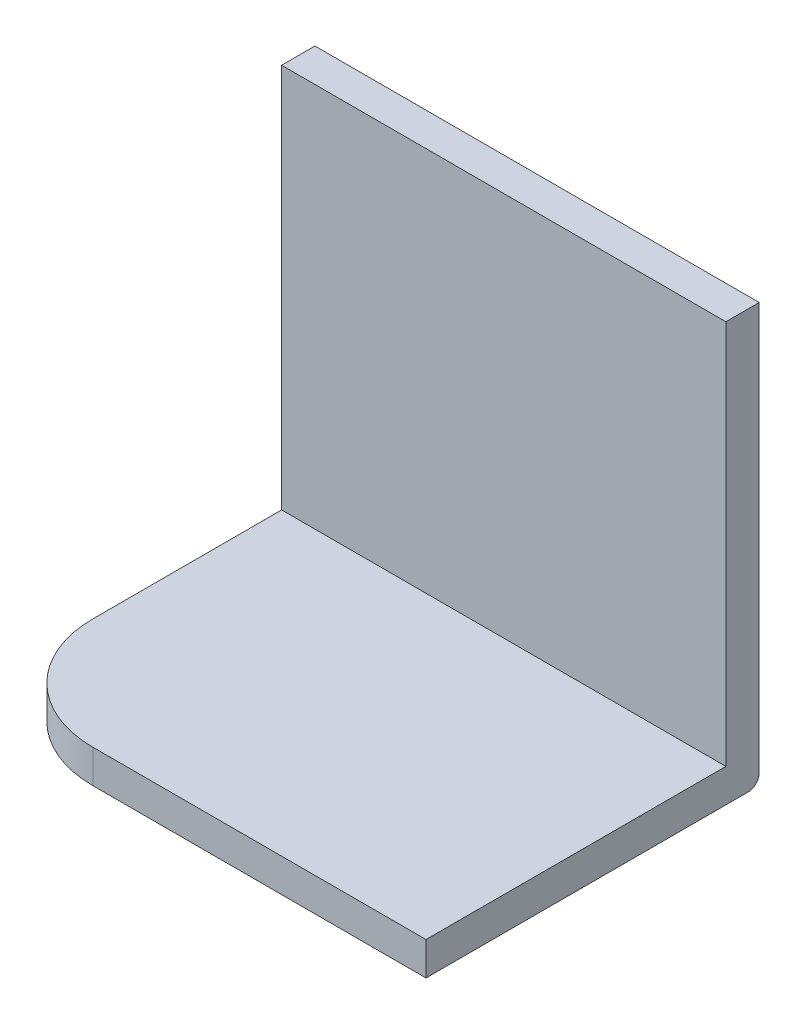
from build123d import *

# Parameters (mm, degrees)
SKETCH_14_W     = 40
SKETCH_14_H     = 3
EXTRUDE_4_DEPTH = 30
FILLET_1_R      = 10
FILLET_3_R      = 1
SKETCH_15_W     = 3
SKETCH_15_H     = 34.674561042
EXTRUDE_1_DEPTH = 20


with BuildPart() as part:
    # 草图14 → 拉伸-薄壁4 (new body)
    with BuildSketch(Plane.XY):
        with Locations((0, -10.200267181)):
            Rectangle(SKETCH_14_W, SKETCH_14_H)
    extrude(amount=EXTRUDE_4_DEPTH)

    # 圆角1
    fillet_1_edges = [part.edges().sort_by_distance(p)[0] for p in [
        (-20, -10.200267181, 30),
    ]]
    fillet(fillet_1_edges, radius=FILLET_1_R)

    # 圆角3
    fillet_3_edges = [part.edges().sort_by_distance(p)[0] for p in [
        (0, -11.700267181, 0),
    ]]
    fillet(fillet_3_edges, radius=FILLET_3_R)

    # 草图15 → 凸台-拉伸1 (add, symmetric)
    with BuildSketch(Plane(origin=(0, 0, 0), x_dir=(0, 0, -1), z_dir=(1, 0, 0))):
        with Locations((-1.5, 8.63701334)):
            Rectangle(SKETCH_15_W, SKETCH_15_H)
    extrude(amount=EXTRUDE_1_DEPTH, both=True)


solid = part.part
